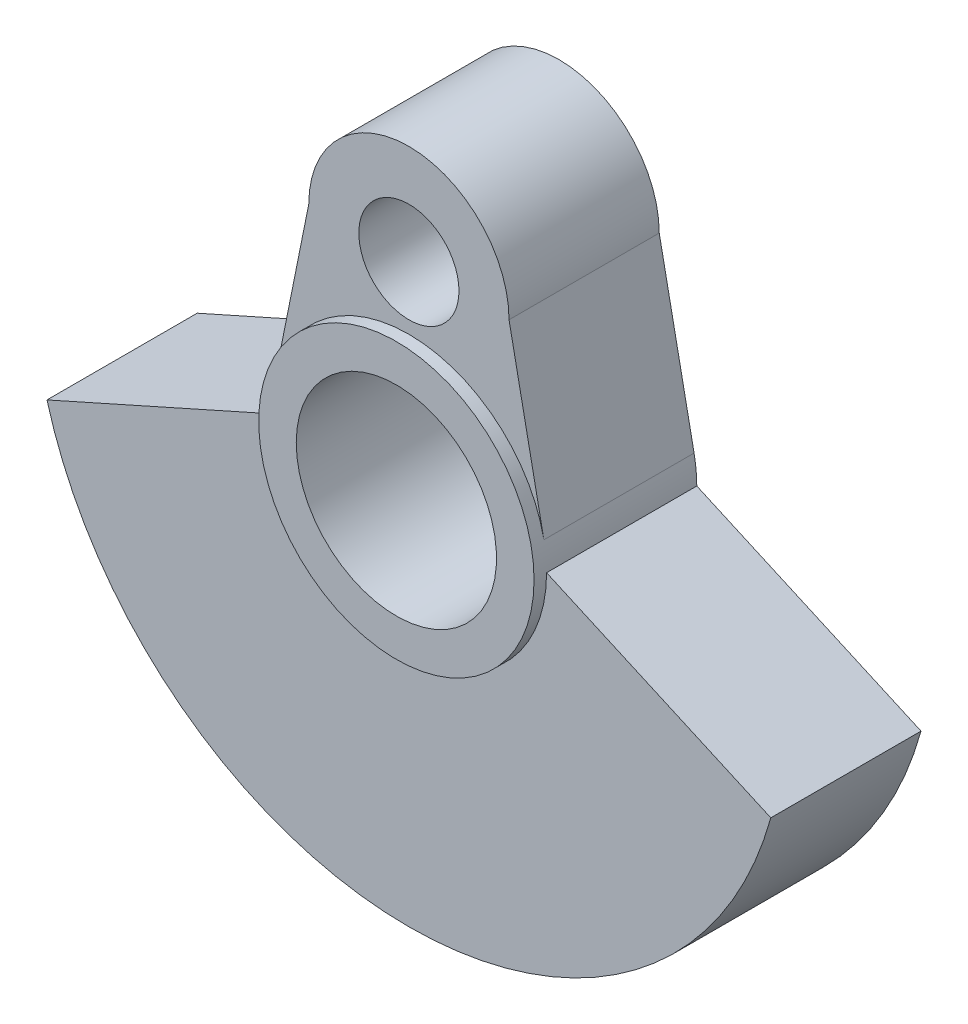
from build123d import *

# Parameters (mm, degrees)
SKETCH2_R             = 2
BOSS_EXTRUDE9_DEPTH   = 3
BOSS_EXTRUDE9_2_DEPTH = 3
BOSS_EXTRUDE10_START  = 3.5
SKETCH2_9_R           = 5.5
SKETCH2_9_R_2         = 4
BOSS_EXTRUDE10_DEPTH  = 6.5


with BuildPart() as part:
    # Sketch2 → Boss-Extrude9 (new, symmetric)
    with BuildSketch(Plane.XY):
        with BuildLine():
            ThreePointArc((4, 8), (0, 12), (-4, 8))
            Line((-4, 8), (-5.391852394, 1.085323803))
            ThreePointArc((-5.391852394, 1.085323803), (0, 5.5), (5.391852394, 1.085323803))
            Line((5.391852394, 1.085323803), (4, 8))
        make_face()
        with Locations((0, 8)):
            Circle(SKETCH2_R, mode=Mode.SUBTRACT)
    extrude(amount=BOSS_EXTRUDE9_DEPTH, both=True)



with BuildPart() as body_2:
    # Sketch2 → Boss-Extrude9 2 (new, symmetric)
    with BuildSketch(Plane.XY):
        with BuildLine():
            ThreePointArc((5.5, 0), (0, -5.5), (-5.5, 0))
            Line((-5.5, 0), (-14.456832295, -4))
            ThreePointArc((-14.456832295, -4), (0, -15), (14.456832295, -4))
            Line((14.456832295, -4), (5.5, 0))
        make_face()
    extrude(amount=BOSS_EXTRUDE9_2_DEPTH, both=True)


with BuildPart() as part_1:
    add(part.part)

    add(body_2.part)  # Boss-Extrude10 merges body 2
    # Sketch2<9> → Boss-Extrude10 (add)
    with BuildSketch(Plane.XY.offset(BOSS_EXTRUDE10_START)):
        Circle(SKETCH2_9_R)
        with Locations(Location((0, 0, 0), (0, 0, 180))):
            Circle(SKETCH2_9_R_2, mode=Mode.SUBTRACT)
    extrude(amount=-BOSS_EXTRUDE10_DEPTH)


solid = part_1.part
